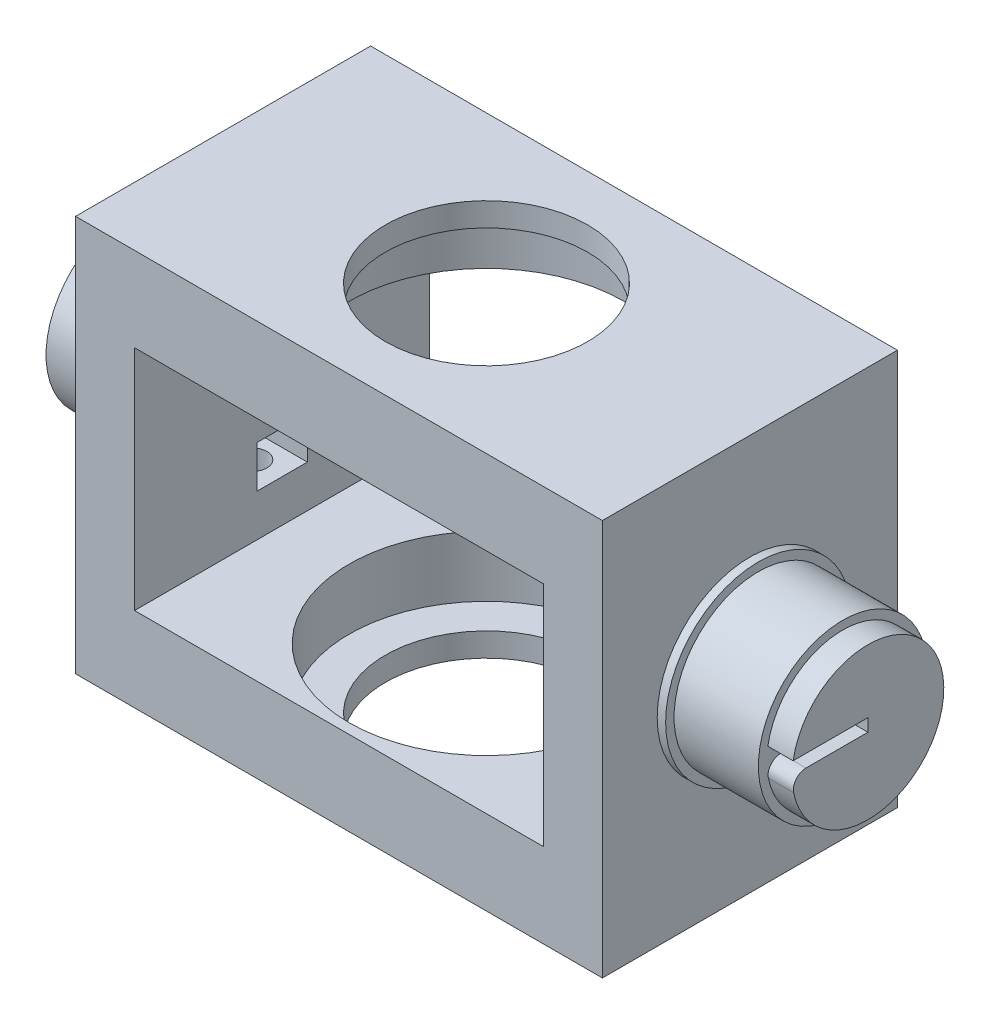
from build123d import *

# Parameters (mm, degrees)
SKETCH_1_W          = 62.5
SKETCH_1_H          = 35
SKETCH_1_R          = 12
EXTRUDE_1_DEPTH     = 10
SKETCH_2_R          = 16.3
CUT_EXTRUDE_1_DEPTH = 7.2
SKETCH_4_W          = 7
SKETCH_4_H          = 35
EXTRUDE_3_DEPTH     = 37
SKETCH_5_R          = 3
CUT_EXTRUDE_3_DEPTH = 3
SKETCH_7_R          = 1.7
CUT_EXTRUDE_4_DEPTH = 20
SKETCH_9_W          = 6
SKETCH_9_H          = 5
CUT_EXTRUDE_5_DEPTH = 7
SKETCH_10_R         = 10
EXTRUDE_4_DEPTH     = 11
SKETCH_11_R         = 11
EXTRUDE_5_DEPTH     = 1
EXTRUDE_6_DEPTH     = 3
CUT_EXTRUDE_6_DEPTH = 5.5


with BuildPart() as part:
    # 草图1 → 凸台-拉伸1 (new body)
    with BuildSketch(Plane(origin=(0, 0, 0), x_dir=(1, 0, 0), z_dir=(0, 1, 0))):
        Rectangle(SKETCH_1_W, SKETCH_1_H)
        with Locations(Location((0, 0, 0), (0, 0, 270))):
            Circle(SKETCH_1_R, mode=Mode.SUBTRACT)
    extrude_1 = extrude(amount=EXTRUDE_1_DEPTH)

    # 草图2 → 切除-拉伸1 (cut)
    with BuildSketch(Plane(origin=(0, 10, 0), x_dir=(1, 0, 0), z_dir=(0, 1, 0))):
        with Locations(Location((0, 0, 0), (0, 0, 270))):
            Circle(SKETCH_2_R)
    cut_extrude_1 = extrude(amount=-CUT_EXTRUDE_1_DEPTH, mode=Mode.SUBTRACT)

    # 草图4 → 凸台-拉伸3 (add)
    with BuildSketch(Plane(origin=(0, 0, 0), x_dir=(1, 0, 0), z_dir=(0, 1, 0))):
        with Locations((27.75, 0)):
            Rectangle(SKETCH_4_W, SKETCH_4_H)
    extrude_3 = extrude(amount=EXTRUDE_3_DEPTH)

    # 草图5 → 切除-拉伸3 (cut)
    with BuildSketch(Plane(origin=(0, 0, 0), x_dir=(1, 0, 0), z_dir=(0, 1, 0))):
        with Locations(Location((27.75, 0, 0), (0, 0, 270))):
            Circle(SKETCH_5_R)
    cut_extrude_3 = extrude(amount=CUT_EXTRUDE_3_DEPTH, mode=Mode.SUBTRACT)

    # 草图7 → 切除-拉伸4 (cut)
    with BuildSketch(Plane(origin=(0, 0, 0), x_dir=(1, 0, 0), z_dir=(0, 1, 0))):
        with Locations(Location((27.75, 0, 0), (0, 0, 270))):
            Circle(SKETCH_7_R)
    cut_extrude_4 = extrude(amount=CUT_EXTRUDE_4_DEPTH, mode=Mode.SUBTRACT)

    # 草图9 → 切除-拉伸5 (cut)
    with BuildSketch(Plane(origin=(31.25, 0, 0), x_dir=(0, 0, -1), z_dir=(1, 0, 0))):
        with Locations((0, 17.5)):
            Rectangle(SKETCH_9_W, SKETCH_9_H)
    cut_extrude_5 = extrude(amount=-CUT_EXTRUDE_5_DEPTH, mode=Mode.SUBTRACT)

    # 镜向4: 凸台-拉伸3, 切除-拉伸3, 切除-拉伸4, 切除-拉伸5 across plane
    add(extrude_3.mirror(Plane.ZY))
    add(cut_extrude_3.mirror(Plane.ZY), mode=Mode.SUBTRACT)
    add(cut_extrude_4.mirror(Plane.ZY), mode=Mode.SUBTRACT)
    add(cut_extrude_5.mirror(Plane.ZY), mode=Mode.SUBTRACT)

    # 镜向5: 凸台-拉伸1, 切除-拉伸1 across plane
    add(extrude_1.mirror(Plane.ZX.offset(23.5)))
    add(cut_extrude_1.mirror(Plane.ZX.offset(23.5)), mode=Mode.SUBTRACT)

    # 草图10 → 凸台-拉伸4 (add)
    with BuildSketch(Plane(origin=(31.25, 0, 0), x_dir=(0, 0, -1), z_dir=(1, 0, 0))):
        with Locations(Location((0, 23.5, 0), (0, 0, 180))):
            Circle(SKETCH_10_R)
    extrude_4 = extrude(amount=EXTRUDE_4_DEPTH)

    # 草图11 → 凸台-拉伸5 (add)
    with BuildSketch(Plane(origin=(31.25, 0, 0), x_dir=(0, 0, -1), z_dir=(1, 0, 0))):
        with Locations(Location((0, 23.5, 0), (0, 0, 180))):
            Circle(SKETCH_11_R)
    extrude_5 = extrude(amount=EXTRUDE_5_DEPTH)

    # 镜向6: 凸台-拉伸4, 凸台-拉伸5 across plane
    add(extrude_4.mirror(Plane.ZY))
    add(extrude_5.mirror(Plane.ZY))

    # 草图12 → 凸台-拉伸6 (add)
    with BuildSketch(Plane(origin=(42.25, 0, 0), x_dir=(0, 0, -1), z_dir=(1, 0, 0))):
        with BuildLine():
            Line((0, 23.5), (-7.348469228, 23.5))
            ThreePointArc((-7.348469228, 23.5), (-8.510364232, 22.948683298), (-8.818163074, 21.7))
            ThreePointArc((-8.818163074, 21.7), (8.998706419, 23.652586976), (-8.874119675, 25))
            Line((-8.874119675, 25), (0, 25))
            Line((0, 25), (0, 23.5))
        make_face()
    extrude(amount=EXTRUDE_6_DEPTH)

    # 草图13 → 切除-拉伸6 (cut)
    with BuildSketch(Plane.ZY.offset(42.25)):
        with BuildLine():
            Line((-1.5612495, 24.75), (1.5612495, 24.75))
            ThreePointArc((1.5612495, 24.75), (2, 23.5), (1.5612495, 22.25))
            Line((1.5612495, 22.25), (-1.5612495, 22.25))
            ThreePointArc((-1.5612495, 22.25), (-2, 23.5), (-1.5612495, 24.75))
        make_face()
    extrude(amount=-CUT_EXTRUDE_6_DEPTH, mode=Mode.SUBTRACT)


solid = part.part
